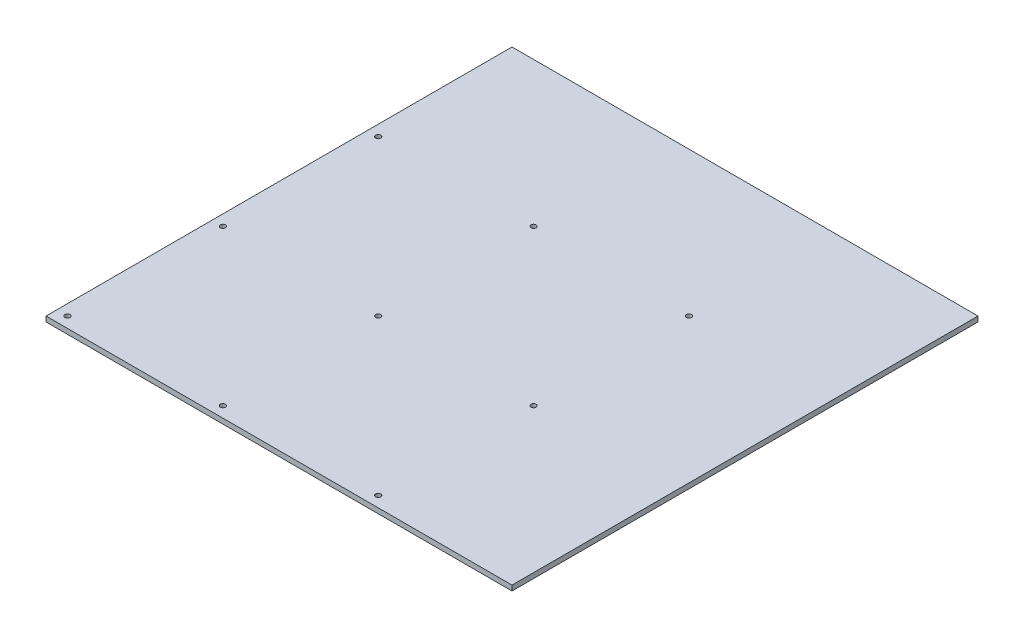
from build123d import *

# Parameters (mm, degrees)
SKETCH1_W           = 540
SKETCH1_H           = 540
SKETCH1_R           = 3
BOSS_EXTRUDE1_DEPTH = 6


with BuildPart() as part:
    # Sketch1 → Boss-Extrude1 (new body)
    with BuildSketch(Plane(origin=(0, 0, 0), x_dir=(1, 0, 0), z_dir=(0, 1, 0))):
        Rectangle(SKETCH1_W, SKETCH1_H)
        with Locations(Location((-257.5, -257.5, 0), (0, 0, 270))):
            Circle(SKETCH1_R, mode=Mode.SUBTRACT)
        with Locations(Location((-77.5, -257.5, 0), (0, 0, 270))):
            Circle(SKETCH1_R, mode=Mode.SUBTRACT)
        with Locations(Location((102.5, -257.5, 0), (0, 0, 270))):
            Circle(SKETCH1_R, mode=Mode.SUBTRACT)
        with Locations(Location((-77.5, -77.5, 0), (0, 0, 270))):
            Circle(SKETCH1_R, mode=Mode.SUBTRACT)
        with Locations(Location((102.5, -77.5, 0), (0, 0, 270))):
            Circle(SKETCH1_R, mode=Mode.SUBTRACT)
        with Locations(Location((-77.5, 102.5, 0), (0, 0, 270))):
            Circle(SKETCH1_R, mode=Mode.SUBTRACT)
        with Locations(Location((102.5, 102.5, 0), (0, 0, 270))):
            Circle(SKETCH1_R, mode=Mode.SUBTRACT)
        with Locations(Location((-257.5, -77.5, 0), (0, 0, 270))):
            Circle(SKETCH1_R, mode=Mode.SUBTRACT)
        with Locations(Location((-257.5, 102.5, 0), (0, 0, 270))):
            Circle(SKETCH1_R, mode=Mode.SUBTRACT)
    extrude(amount=BOSS_EXTRUDE1_DEPTH)


solid = part.part
